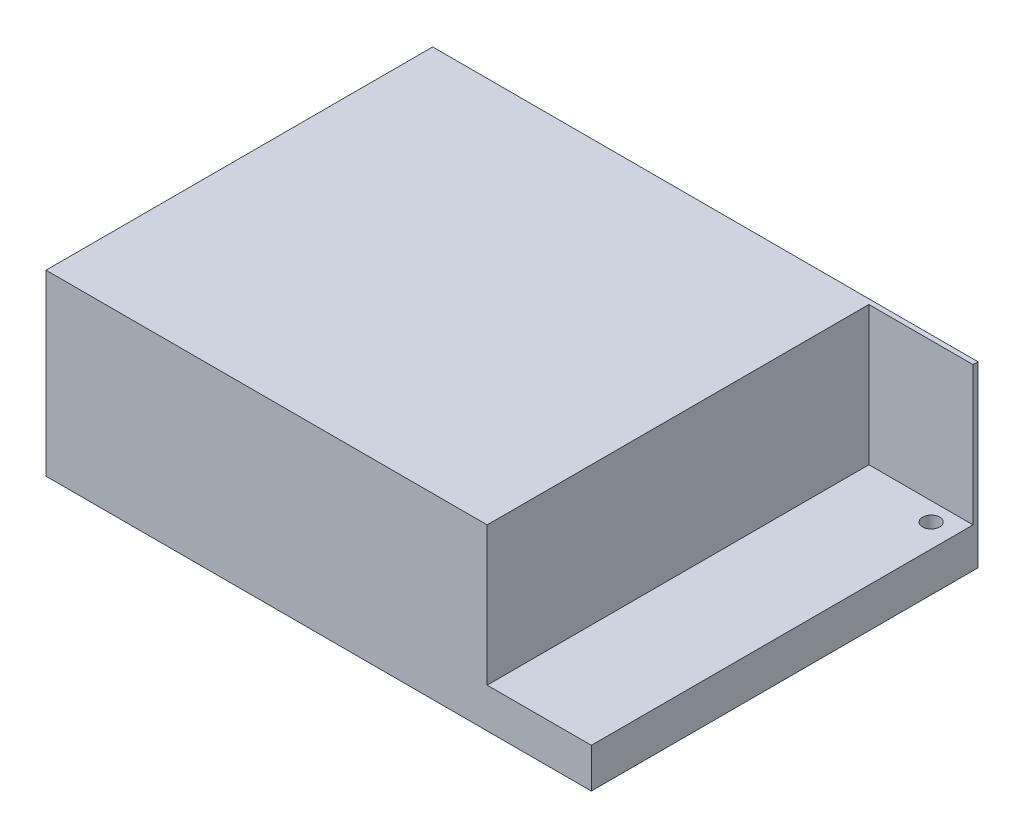
from build123d import *

# Parameters (mm, degrees)
SKETCH1_W           = 110
SKETCH1_H           = 78
BOSS_EXTRUDE1_DEPTH = 36
SKETCH2_W           = 21.010174998
SKETCH2_H           = 77
CUT_EXTRUDE1_DEPTH  = 28
SKETCH3_R           = 1.725
CUT_EXTRUDE2_DEPTH  = 89.2743541
SKETCH4_R           = 1.5
CUT_EXTRUDE3_DEPTH  = 5


with BuildPart() as part:
    # Sketch1 → Boss-Extrude1 (new body)
    with BuildSketch(Plane(origin=(0, 0, 0), x_dir=(1, 0, 0), z_dir=(0, 1, 0))):
        with Locations((8.088235294, -16.029411765)):
            Rectangle(SKETCH1_W, SKETCH1_H)
    extrude(amount=BOSS_EXTRUDE1_DEPTH)

    # Sketch2 → Cut-Extrude1 (cut)
    with BuildSketch(Plane(origin=(0, 36, 0), x_dir=(1, 0, 0), z_dir=(0, 1, 0))):
        with Locations((52.583147795, -16.529411765)):
            Rectangle(SKETCH2_W, SKETCH2_H)
    extrude(amount=-CUT_EXTRUDE1_DEPTH, mode=Mode.SUBTRACT)

    # Sketch3 → Cut-Extrude2 (cut, through all)
    with BuildSketch(Plane(origin=(0, 8, 0), x_dir=(1, 0, 0), z_dir=(0, 1, 0))):
        with Locations(Location((58.363235294, 18.245588235, 0), (0, 0, 270))):
            Circle(SKETCH3_R)
    extrude(amount=-CUT_EXTRUDE2_DEPTH, mode=Mode.SUBTRACT)

    # Sketch4 → Cut-Extrude3 (cut)
    with BuildSketch(Plane.XZ):
        with Locations(Location((-4.911764706, 2.129411765, 0), (0, 0, 270))):
            Circle(SKETCH4_R)
        with Locations(Location((-4.911764706, 30.729411765, 0), (0, 0, 270))):
            Circle(SKETCH4_R)
        with Locations(Location((30.838235294, 30.729411765, 0), (0, 0, 270))):
            Circle(SKETCH4_R)
    extrude(amount=-CUT_EXTRUDE3_DEPTH, mode=Mode.SUBTRACT)


solid = part.part
